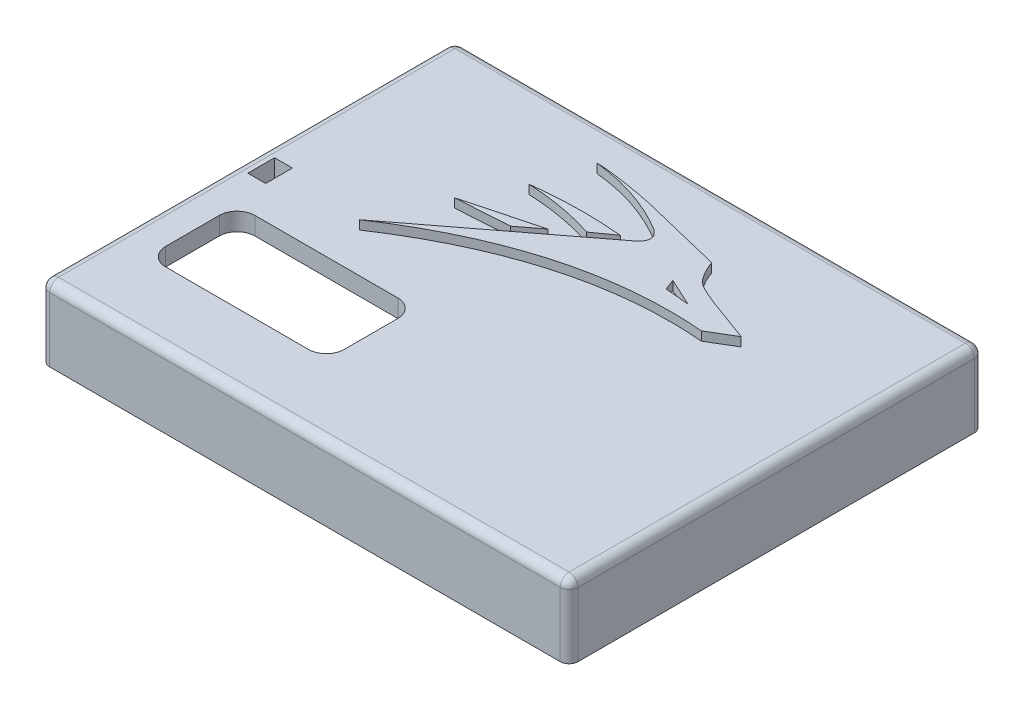
from build123d import *

# Parameters (mm, degrees)
EXTRUDE_1_DEPTH     = 57.2
SKETCH_2_W          = 2
SKETCH_2_H          = 1.6
EXTRUDE_2_DEPTH     = 57.2
CHAMFER_1_SIZE      = 0.5
SKETCH_3_W          = 46.4
SKETCH_3_H          = 8.2
EXTRUDE_3_DEPTH     = 2
SKETCH_4_W          = 20
SKETCH_4_H          = 10
CUT_EXTRUDE_1_DEPTH = 2
FILLET_1_R          = 1
FILLET_2_R          = 2
SKETCH_5_W          = 2
SKETCH_5_H          = 3
CUT_EXTRUDE_2_DEPTH = 2
EXTRUDE_4_DEPTH     = 1


with BuildPart() as part:
    # 草图1 → 凸台-拉伸1 (new body)
    with BuildSketch(Plane(origin=(0, 0, 0), x_dir=(0, 0, -1), z_dir=(1, 0, 0))):
        Polygon((-3.2, 0), (-0.2, 0), (-0.2, 6.2), (40.2, 6.2), (40.2, 0), (43.2, 0), (43.2, 8.2), (-3.2, 8.2), align=None)
    extrude(amount=EXTRUDE_1_DEPTH)

    # 草图2 → 凸台-拉伸2 (add)
    with BuildSketch(Plane.ZY):
        with Locations((-39.2, 3)):
            Rectangle(SKETCH_2_W, SKETCH_2_H)
        with Locations((-0.8, 3)):
            Rectangle(SKETCH_2_W, SKETCH_2_H)
    extrude(amount=-EXTRUDE_2_DEPTH)

    # 倒角1
    chamfer_1_edges = [part.edges().sort_by_distance(p)[0] for p in [
        (0, 2.2, -39.2),
        (0, 3, -38.2),
        (0, 3.8, -39.2),
        (0, 3.8, -0.8),
        (0, 3, -1.8),
        (0, 2.2, -0.8),
    ]]
    chamfer(chamfer_1_edges, length=CHAMFER_1_SIZE)

    # 草图3 → 凸台-拉伸3 (add)
    with BuildSketch(Plane(origin=(57.2, 0, 0), x_dir=(0, 0, -1), z_dir=(1, 0, 0))):
        with Locations((20, 4.1)):
            Rectangle(SKETCH_3_W, SKETCH_3_H)
    extrude(amount=EXTRUDE_3_DEPTH)

    # 草图4 → 切除-拉伸1 (cut)
    with BuildSketch(Plane(origin=(0, 8.2, 0), x_dir=(1, 0, 0), z_dir=(0, 1, 0))):
        with Locations((14, 9.8)):
            Rectangle(SKETCH_4_W, SKETCH_4_H)
    extrude(amount=-CUT_EXTRUDE_1_DEPTH, mode=Mode.SUBTRACT)

    # 圆角1
    fillet_1_edges = [part.edges().sort_by_distance(p)[0] for p in [
        (29.6, 8.2, 3.2),
        (29.6, 8.2, -43.2),
        (0, 4.1, 3.2),
        (0, 8.2, -20),
        (0, 4.1, -43.2),
        (59.2, 4.1, 3.2),
        (59.2, 4.1, -43.2),
        (59.2, 8.2, -20),
    ]]
    fillet(fillet_1_edges, radius=FILLET_1_R)

    # 圆角2
    fillet_2_edges = [part.edges().sort_by_distance(p)[0] for p in [
        (4, 7.2, -4.8),
        (4, 7.2, -14.8),
        (24, 7.2, -14.8),
        (24, 7.2, -4.8),
    ]]
    fillet(fillet_2_edges, radius=FILLET_2_R)

    # 草图5 → 切除-拉伸2 (cut)
    with BuildSketch(Plane(origin=(0, 8.2, 0), x_dir=(1, 0, 0), z_dir=(0, 1, 0))):
        with Locations((2.5, 20)):
            Rectangle(SKETCH_5_W, SKETCH_5_H)
    extrude(amount=-CUT_EXTRUDE_2_DEPTH, mode=Mode.SUBTRACT)

    # 草图6 → 凸台-拉伸4 (add)
    # profile 1 of 3: a face of its own
    with BuildSketch(Plane(origin=(0, 8.2, 0), x_dir=(1, 0, 0), z_dir=(0, 1, 0))):
        with BuildLine():
            Line((43.210238434, 27.609218662), (46.004565148, 29.278219616))
            Line((46.004565148, 29.278219616), (41.153736267, 31.052319712))
            add(Edge.make_bspline(
                [(41.153736267, 31.052319712), (38.917601784, 31.936798518), (38.081456616, 32.783594578), (37.429599552, 34.039752086), (37.178253479, 34.799893267)],
                knots=[0, 0, 0, 0, 0.258597765, 0.606503624, 0.606503624, 0.606503624, 0.606503624], degree=3))
            add(Edge.make_bspline(
                [(37.178253479, 34.799893267), (27.495556624, 37.127469308), (28.540823689, 37.034185208), (22.273471515, 38.064657168), (21.101157932, 38.034742746)],
                knots=[0, 0, 0, 0, 0.625762474, 1, 1, 1, 1], degree=3))
            add(Edge.make_bspline(
                [(21.101157932, 38.034742746), (26.275616415, 37.491858388), (30.685853804, 34.799893267)],
                knots=[0, 0, 0, 1, 1, 1], degree=2))
            add(Edge.make_bspline(
                [(30.685853804, 34.799893267), (32.176490653, 33.72226655), (30.681444749, 32.541026773)],
                knots=[0, 0, 0, 1, 1, 1], degree=2))
            Line((30.681444749, 32.541026773), (13.273453583, 19.243046464))
            add(Edge.make_bspline(
                [(13.273453583, 19.243046464), (27.82860145, 28.923958356), (43.210238434, 27.609218662)],
                knots=[0, 0, 0, 0.904008086, 0.904008086, 0.904008086], degree=2))
        make_face()
        Polygon((36.709764713, 30.912438237), (37.178253479, 29.699300691), (39.856659814, 29.454156879), align=None, mode=Mode.SUBTRACT)
    # profile 2 of 3: a face of its own
    with BuildSketch(Plane(origin=(0, 8.2, 0), x_dir=(1, 0, 0), z_dir=(0, 1, 0))):
        with BuildLine():
            Line((29.392459455, 32.336818489), (27.193702695, 30.773846816))
            add(Edge.make_bspline(
                [(19.299371197, 32.177872217), (23.346710302, 32.024077211), (27.193702695, 30.773846816)],
                knots=[0, 0, 0, 1, 1, 1], degree=2))
            add(Edge.make_bspline(
                [(19.299371197, 32.177872217), (24.339492566, 32.815798813), (29.392459455, 32.336818489)],
                knots=[0, 0, 0, 1, 1, 1], degree=2))
        make_face()
    # profile 3 of 3: a face of its own
    with BuildSketch(Plane(origin=(0, 8.2, 0), x_dir=(1, 0, 0), z_dir=(0, 1, 0))):
        Polygon((16.46482935, 26.694225841), (24.730035483, 28.8929826), (22.359389371, 27.082043876), align=None)
    extrude(amount=EXTRUDE_4_DEPTH)


solid = part.part
